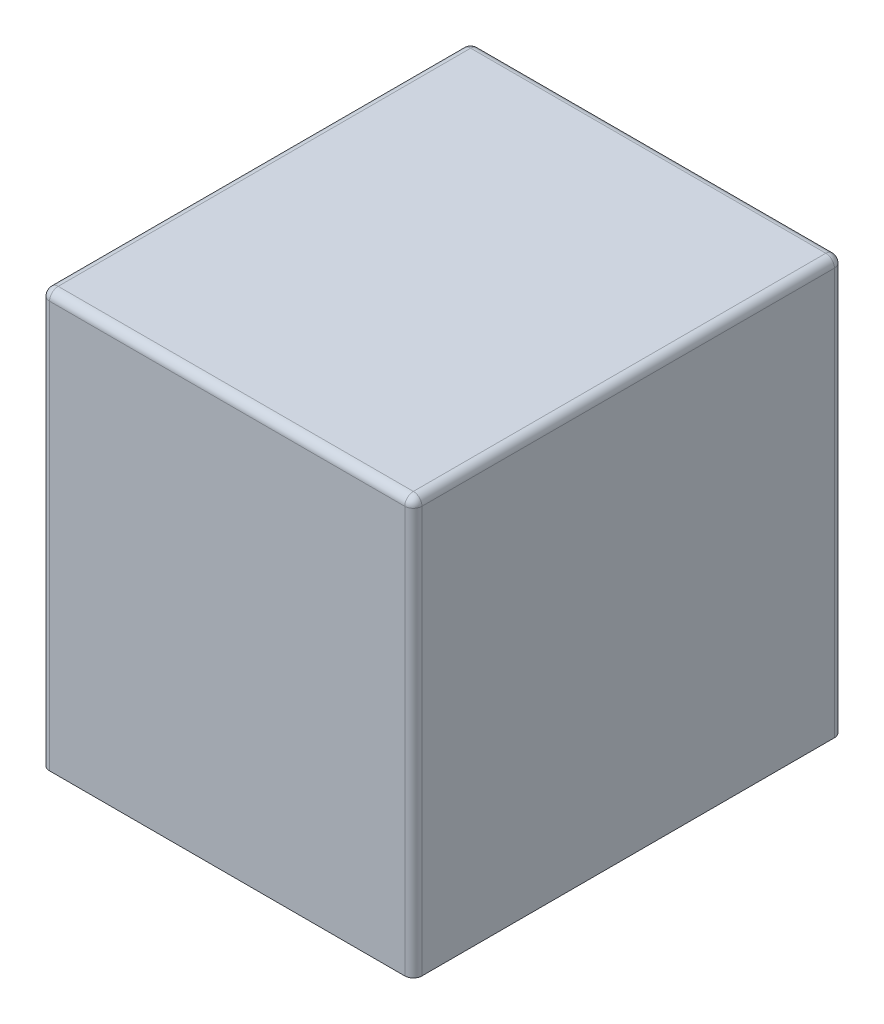
from build123d import *

# Parameters (mm, degrees)
SKETCH1_W           = 130
SKETCH1_H           = 150
SKETCH1_W_2         = 120
SKETCH1_H_2         = 140
BOSS_EXTRUDE1_DEPTH = 140
SKETCH2_W           = 130
SKETCH2_H           = 150
BOSS_EXTRUDE2_DEPTH = 5
CUT_EXTRUDE1_DEPTH  = 12
FILLET1_R           = 3


with BuildPart() as part:
    # Sketch1 → Boss-Extrude1 (new body)
    with BuildSketch(Plane(origin=(0, 0, 0), x_dir=(1, 0, 0), z_dir=(0, 1, 0))):
        Rectangle(SKETCH1_W, SKETCH1_H)
        Rectangle(SKETCH1_W_2, SKETCH1_H_2, mode=Mode.SUBTRACT)
    extrude(amount=BOSS_EXTRUDE1_DEPTH)

    # Sketch2 → Boss-Extrude2 (add)
    with BuildSketch(Plane(origin=(0, 140, 0), x_dir=(1, 0, 0), z_dir=(0, 1, 0))):
        Rectangle(SKETCH2_W, SKETCH2_H)
    extrude(amount=BOSS_EXTRUDE2_DEPTH)

    # Sketch3 → Cut-Extrude1 (cut)
    with BuildSketch(Plane.XZ):
        with BuildLine():
            ThreePointArc((1.45, -72.5), (0, -71.05), (-1.45, -72.5))
            Line((-1.45, -72.5), (1.45, -72.5))
        make_face()
        with BuildLine():
            Line((1.45, -72.5), (-1.45, -72.5))
            ThreePointArc((-1.45, -72.5), (0, -73.95), (1.45, -72.5))
        make_face()
        with BuildLine():
            ThreePointArc((63.95, -72.5), (63.525304833, -71.474695167), (62.5, -71.05))
            Line((62.5, -71.05), (62.5, -72.5))
            Line((62.5, -72.5), (61.05, -72.5))
            ThreePointArc((61.05, -72.5), (62.5, -73.95), (63.95, -72.5))
        make_face()
        with BuildLine():
            Line((62.5, -72.5), (62.5, -71.05))
            ThreePointArc((62.5, -71.05), (61.474695167, -71.474695167), (61.05, -72.5))
            Line((61.05, -72.5), (62.5, -72.5))
        make_face()
        with BuildLine():
            ThreePointArc((63.95, 0), (63.525304833, 1.025304833), (62.5, 1.45))
            Line((62.5, 1.45), (62.5, -1.45))
            ThreePointArc((62.5, -1.45), (63.525304833, -1.025304833), (63.95, 0))
        make_face()
        with BuildLine():
            Line((62.5, -1.45), (62.5, 1.45))
            ThreePointArc((62.5, 1.45), (61.05, 0), (62.5, -1.45))
        make_face()
        with BuildLine():
            ThreePointArc((63.95, 72.5), (62.5, 73.95), (61.05, 72.5))
            Line((61.05, 72.5), (62.5, 72.5))
            Line((62.5, 72.5), (62.5, 71.05))
            ThreePointArc((62.5, 71.05), (63.525304833, 71.474695167), (63.95, 72.5))
        make_face()
        with BuildLine():
            Line((62.5, 72.5), (61.05, 72.5))
            ThreePointArc((61.05, 72.5), (61.474695167, 71.474695167), (62.5, 71.05))
            Line((62.5, 71.05), (62.5, 72.5))
        make_face()
        with BuildLine():
            ThreePointArc((1.45, 72.5), (0, 73.95), (-1.45, 72.5))
            Line((-1.45, 72.5), (1.45, 72.5))
        make_face()
        with BuildLine():
            Line((1.45, 72.5), (-1.45, 72.5))
            ThreePointArc((-1.45, 72.5), (0, 71.05), (1.45, 72.5))
        make_face()
        with BuildLine():
            Line((-62.5, 71.05), (-62.5, 72.5))
            Line((-62.5, 72.5), (-61.05, 72.5))
            ThreePointArc((-61.05, 72.5), (-63.525304833, 73.525304833), (-62.5, 71.05))
        make_face()
        with BuildLine():
            Line((-61.05, 72.5), (-62.5, 72.5))
            Line((-62.5, 72.5), (-62.5, 71.05))
            ThreePointArc((-62.5, 71.05), (-61.474695167, 71.474695167), (-61.05, 72.5))
        make_face()
        with BuildLine():
            ThreePointArc((-61.05, 0), (-61.474695167, 1.025304833), (-62.5, 1.45))
            Line((-62.5, 1.45), (-62.5, -1.45))
            ThreePointArc((-62.5, -1.45), (-61.474695167, -1.025304833), (-61.05, 0))
        make_face()
        with BuildLine():
            Line((-62.5, -1.45), (-62.5, 1.45))
            ThreePointArc((-62.5, 1.45), (-63.95, 0), (-62.5, -1.45))
        make_face()
        with BuildLine():
            ThreePointArc((-61.05, -72.5), (-61.474695167, -71.474695167), (-62.5, -71.05))
            Line((-62.5, -71.05), (-62.5, -72.5))
            Line((-62.5, -72.5), (-61.05, -72.5))
        make_face()
        with BuildLine():
            Line((-62.5, -72.5), (-62.5, -71.05))
            ThreePointArc((-62.5, -71.05), (-63.525304833, -73.525304833), (-61.05, -72.5))
            Line((-61.05, -72.5), (-62.5, -72.5))
        make_face()
    extrude(amount=-CUT_EXTRUDE1_DEPTH, mode=Mode.SUBTRACT)

    # Fillet1
    fillet1_edges = [part.edges().sort_by_distance(p)[0] for p in [
        (0, 145, -75),
        (-65, 145, 0),
        (0, 145, 75),
        (65, 145, 0),
        (-65, 72.5, -75),
        (65, 72.5, -75),
        (65, 72.5, 75),
        (-65, 72.5, 75),
    ]]
    fillet(fillet1_edges, radius=FILLET1_R)


solid = part.part
